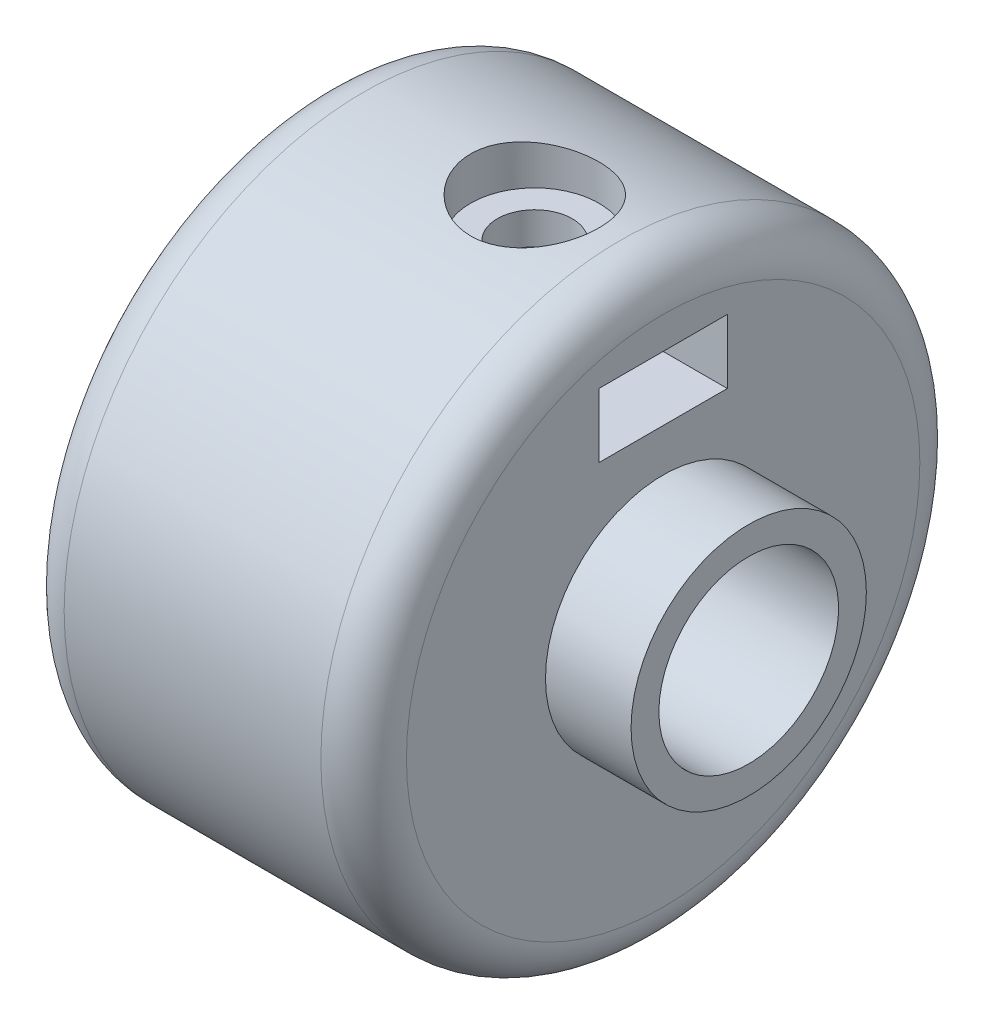
from build123d import *

# Parameters (mm, degrees)
SKETCH_2_R          = 1.75
CUT_EXTRUDE_5_DEPTH = 29.142494559
CUT_EXTRUDE_START   = 14
SKETCH_2_4_R        = 3
CUT_EXTRUDE_6_DEPTH = 2
SKETCH_4_W          = 6
SKETCH_4_H          = 3
CUT_EXTRUDE_7_DEPTH = 15
FILLET_1_R          = 2


with BuildPart() as part:
    # 草图1 → 旋转1 (revolve)
    with BuildSketch(Plane.XY):
        Polygon((-15, 4.2), (0, 4.2), (0, 5.5), (-4, 5.5), (-4, 14), (-20, 14), (-20, 0), (-15, 0), align=None)
    revolve(axis=Axis((-12.015902685, 0, 0), (1, 0, 0)))

    # 草图2 → 切除-拉伸5 (cut, through all)
    with BuildSketch(Plane(origin=(0, 0, 0), x_dir=(1, 0, 0), z_dir=(0, 1, 0))):
        with Locations((-10, 0)):
            Circle(SKETCH_2_R)
    extrude(amount=CUT_EXTRUDE_5_DEPTH, mode=Mode.SUBTRACT)

    # 草图2<4> → 切除-拉伸6 (cut)
    with BuildSketch(Plane(origin=(0, 0, 0), x_dir=(1, 0, 0), z_dir=(0, 1, 0)).offset(CUT_EXTRUDE_START)):
        with Locations((-10, 0)):
            Circle(SKETCH_2_4_R)
    extrude(amount=-CUT_EXTRUDE_6_DEPTH, mode=Mode.SUBTRACT)

    # 草图4 → 切除-拉伸7 (cut)
    with BuildSketch(Plane(origin=(0, 0, 0), x_dir=(0, 0, -1), z_dir=(1, 0, 0))):
        with Locations((0, 9)):
            Rectangle(SKETCH_4_W, SKETCH_4_H)
    extrude(amount=-CUT_EXTRUDE_7_DEPTH, mode=Mode.SUBTRACT)

    # 圆角1
    fillet_1_edges = [part.edges().sort_by_distance(p)[0] for p in [
        (-20, -14, 0),
        (-4, -14, 0),
    ]]
    fillet(fillet_1_edges, radius=FILLET_1_R)


solid = part.part
